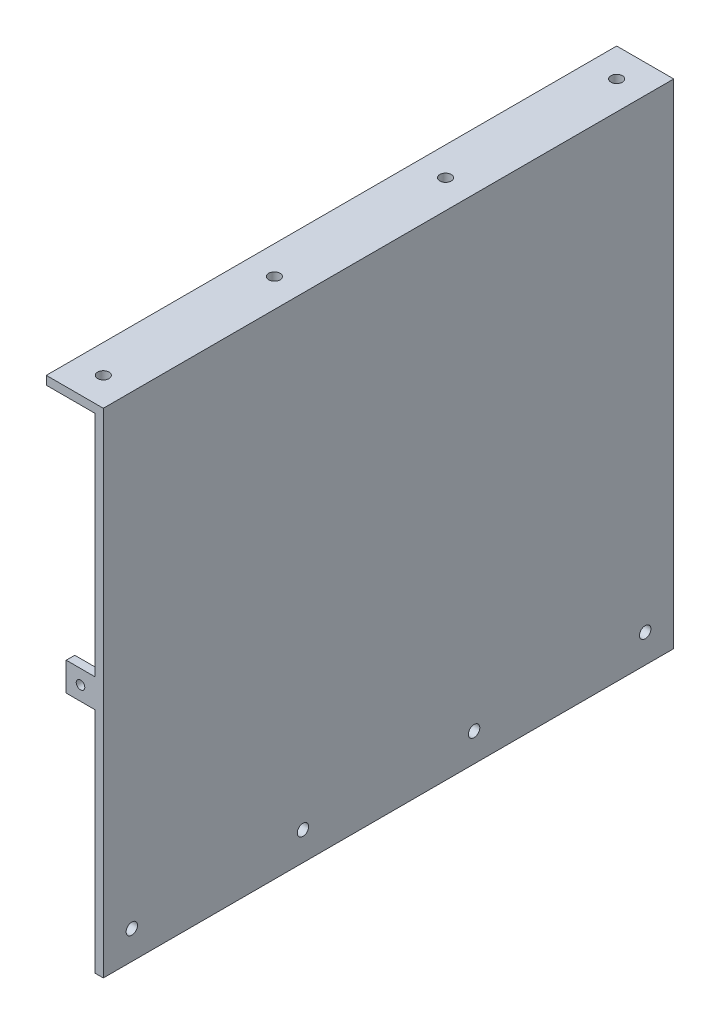
from build123d import *

# Parameters (mm, degrees)
SKETCH1_W           = 20
SKETCH1_H           = 200
BOSS_EXTRUDE1_DEPTH = 3
SKETCH2_W           = 3
SKETCH2_H           = 200
BOSS_EXTRUDE2_DEPTH = 170
CUT_EXTRUDE1_REACH  = 202.072
SKETCH3_R           = 2
LPATTERN1_COUNT     = 4
LPATTERN1_PITCH     = 60
CUT_EXTRUDE2_REACH  = 200.242
SKETCH4_R           = 2
LPATTERN2_COUNT     = 4
LPATTERN2_PITCH     = 60
SKETCH5_W           = 3
SKETCH5_H           = 10
BOSS_EXTRUDE3_DEPTH = 10
CUT_EXTRUDE3_REACH  = 264.679
SKETCH6_R           = 1.5


with BuildPart() as part:
    # Sketch1 → Boss-Extrude1 (new body)
    with BuildSketch(Plane(origin=(0, 0, 0), x_dir=(1, 0, 0), z_dir=(0, 1, 0))):
        Rectangle(SKETCH1_W, SKETCH1_H)
    extrude(amount=BOSS_EXTRUDE1_DEPTH)

    # Sketch2 → Boss-Extrude2 (add)
    with BuildSketch(Plane.XZ):
        with Locations((8.5, 0)):
            Rectangle(SKETCH2_W, SKETCH2_H)
    extrude(amount=BOSS_EXTRUDE2_DEPTH)

    # Sketch3 → Cut-Extrude1 (cut, up to next)
    with BuildSketch(Plane(origin=(0, 3, 0), x_dir=(1, 0, 0), z_dir=(0, 1, 0)), mode=Mode.PRIVATE) as cut_extrude1_sk1:
        with Locations(Location((0, -90, 0), (0, 0, 270))):
            Circle(SKETCH3_R)
    cut_extrude1_tool1 = extrude(cut_extrude1_sk1.sketch, amount=-CUT_EXTRUDE1_REACH, mode=Mode.PRIVATE) & part.part
    cut_extrude1 = cut_extrude1_tool1.solids().sort_by_distance((0, 3, 90))[0]
    add(cut_extrude1, mode=Mode.SUBTRACT)

    # LPattern1: Cut-Extrude1 ×4
    with Locations(*[(0, 0, -i * LPATTERN1_PITCH) for i in range(1, LPATTERN1_COUNT)]):
        add(cut_extrude1, mode=Mode.SUBTRACT)

    # Sketch4 → Cut-Extrude2 (cut, up to next)
    with BuildSketch(Plane(origin=(10, 0, 0), x_dir=(0, 0, -1), z_dir=(1, 0, 0)), mode=Mode.PRIVATE) as cut_extrude2_sk1:
        with Locations((90, -160)):
            Circle(SKETCH4_R)
    cut_extrude2_tool1 = extrude(cut_extrude2_sk1.sketch, amount=-CUT_EXTRUDE2_REACH, mode=Mode.PRIVATE) & part.part
    cut_extrude2 = cut_extrude2_tool1.solids().sort_by_distance((10, -160, -90))[0]
    add(cut_extrude2, mode=Mode.SUBTRACT)

    # LPattern2: Cut-Extrude2 ×4
    with Locations(*[(0, 0, i * LPATTERN2_PITCH) for i in range(1, LPATTERN2_COUNT)]):
        add(cut_extrude2, mode=Mode.SUBTRACT)

    # Sketch5 → Boss-Extrude3 (add)
    with BuildSketch(Plane.ZY.offset(-7)):
        with Locations((-98.5, -85)):
            Rectangle(SKETCH5_W, SKETCH5_H)
    boss_extrude3 = extrude(amount=BOSS_EXTRUDE3_DEPTH)

    # Sketch6 → Cut-Extrude3 (cut, up to next)
    with BuildSketch(Plane(origin=(0, 0, -100), x_dir=(-1, 0, 0), z_dir=(0, 0, -1)), mode=Mode.PRIVATE) as cut_extrude3_sk1:
        with Locations((-2, -85)):
            Circle(SKETCH6_R)
    cut_extrude3_tool1 = extrude(cut_extrude3_sk1.sketch, amount=-CUT_EXTRUDE3_REACH, mode=Mode.PRIVATE) & part.part
    cut_extrude3 = cut_extrude3_tool1.solids().sort_by_distance((2, -85, -100))[0]
    add(cut_extrude3, mode=Mode.SUBTRACT)

    # Mirror1: Boss-Extrude3, Cut-Extrude3 across plane
    add(boss_extrude3.mirror(Plane.XY))
    add(cut_extrude3.mirror(Plane.XY), mode=Mode.SUBTRACT)


solid = part.part
